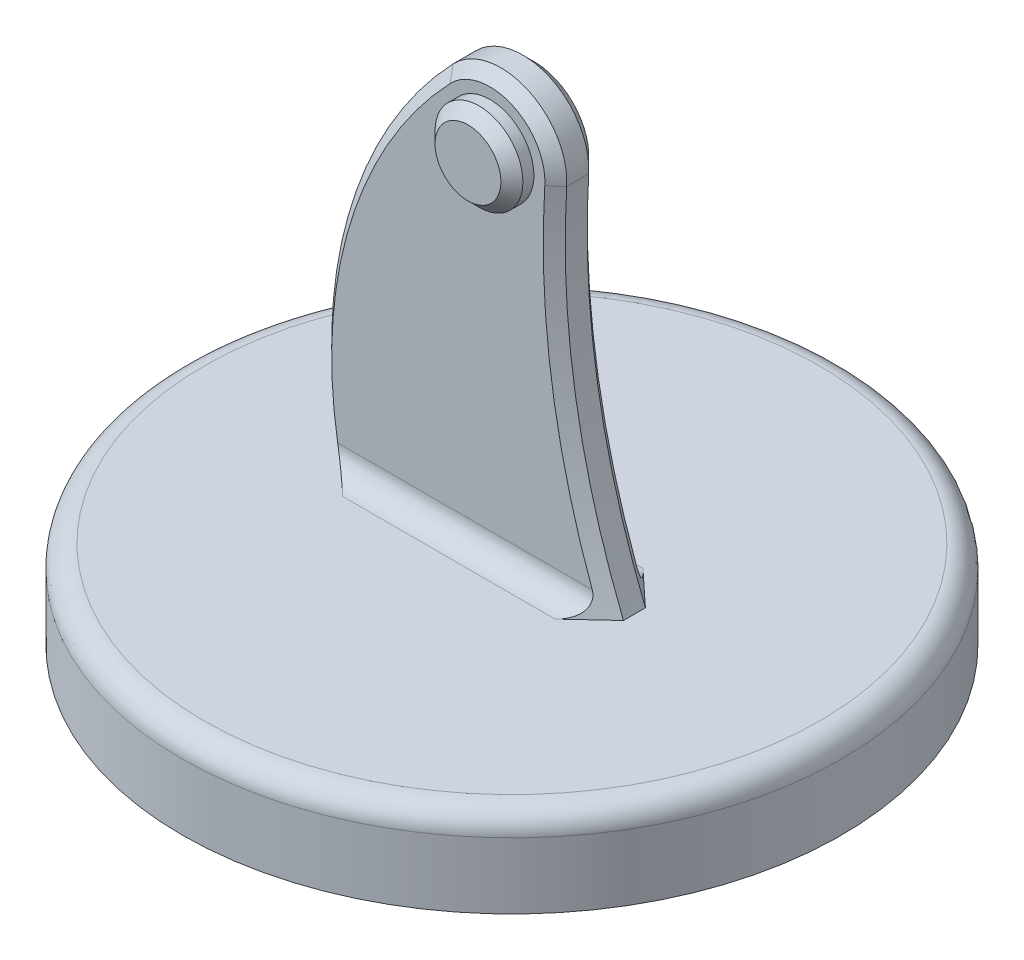
from build123d import *

# Parameters (mm, degrees)
SKETCH_1_R          = 75
EXTRUDE_1_DEPTH     = 20
FILLET_2_R          = 5
EXTRUDE_2_DEPTH     = 5
CHAMFER_1_SIZE      = 2.5
FILLET_3_R          = 5
SKETCH_5_R          = 10
EXTRUDE_3_DEPTH     = 5
CHAMFER_2_SIZE      = 2.5
SKETCH_6_R          = 5
CUT_EXTRUDE_1_DEPTH = 10


with BuildPart() as part:
    # 草图1 → 凸台-拉伸1 (new body)
    with BuildSketch(Plane(origin=(0, 0, 0), x_dir=(1, 0, 0), z_dir=(0, 1, 0))):
        with Locations(Location((0, 0, 0), (0, 0, 270))):
            Circle(SKETCH_1_R)
    extrude(amount=EXTRUDE_1_DEPTH)

    # 圆角2
    fillet_2_edges = [part.edges().sort_by_distance(p)[0] for p in [
        (0, 20, -75),
    ]]
    fillet(fillet_2_edges, radius=FILLET_2_R)

    # 草图4 → 凸台-拉伸2 (add, symmetric)
    with BuildSketch(Plane.XY):
        with BuildLine():
            Line((30, 15), (-35, 15))
            ThreePointArc((-35, 15), (-35.460543036, 65.854059614), (-10.849201429, 110.358321696))
            ThreePointArc((-10.849201429, 110.358321696), (6.012327577, 113.742340307), (14.970645506, 99.06203778))
            ThreePointArc((14.970645506, 99.06203778), (17.428098582, 56.126843631), (30, 15))
        make_face()
    extrude(amount=EXTRUDE_2_DEPTH, both=True)

    # 倒角1
    chamfer_1_edges = [part.edges().sort_by_distance(p)[0] for p in [
        (-34.796467261, 68.341174934, -5),
        (16.970295051, 58.803839559, -5),
        (6.012327577, 113.742340307, -5),
        (16.970295051, 58.803839559, 5),
        (6.012327577, 113.742340307, 5),
        (-34.796467261, 68.341174934, 5),
    ]]
    chamfer(chamfer_1_edges, length=CHAMFER_1_SIZE)

    # 圆角3
    fillet_3_edges = [part.edges().sort_by_distance(p)[0] for p in [
        (-4.241511046, 20, -5),
        (-4.241511046, 20, 5),
    ]]
    fillet(fillet_3_edges, radius=FILLET_3_R)

    # 草图5 → 凸台-拉伸3 (add)
    with BuildSketch(Plane.XY.offset(5)):
        with Locations(Location((0, 100, 0), (0, 0, 180))):
            Circle(SKETCH_5_R)
    extrude(amount=EXTRUDE_3_DEPTH)

    # 倒角2
    chamfer_2_edges = [part.edges().sort_by_distance(p)[0] for p in [
        (10, 100, 10),
    ]]
    chamfer(chamfer_2_edges, length=CHAMFER_2_SIZE)

    # 草图6 → 切除-拉伸1 (cut)
    with BuildSketch(Plane(origin=(0, 0, -5), x_dir=(-1, 0, 0), z_dir=(0, 0, -1))):
        with Locations((0, 100)):
            Circle(SKETCH_6_R)
    extrude(amount=-CUT_EXTRUDE_1_DEPTH, mode=Mode.SUBTRACT)


solid = part.part
